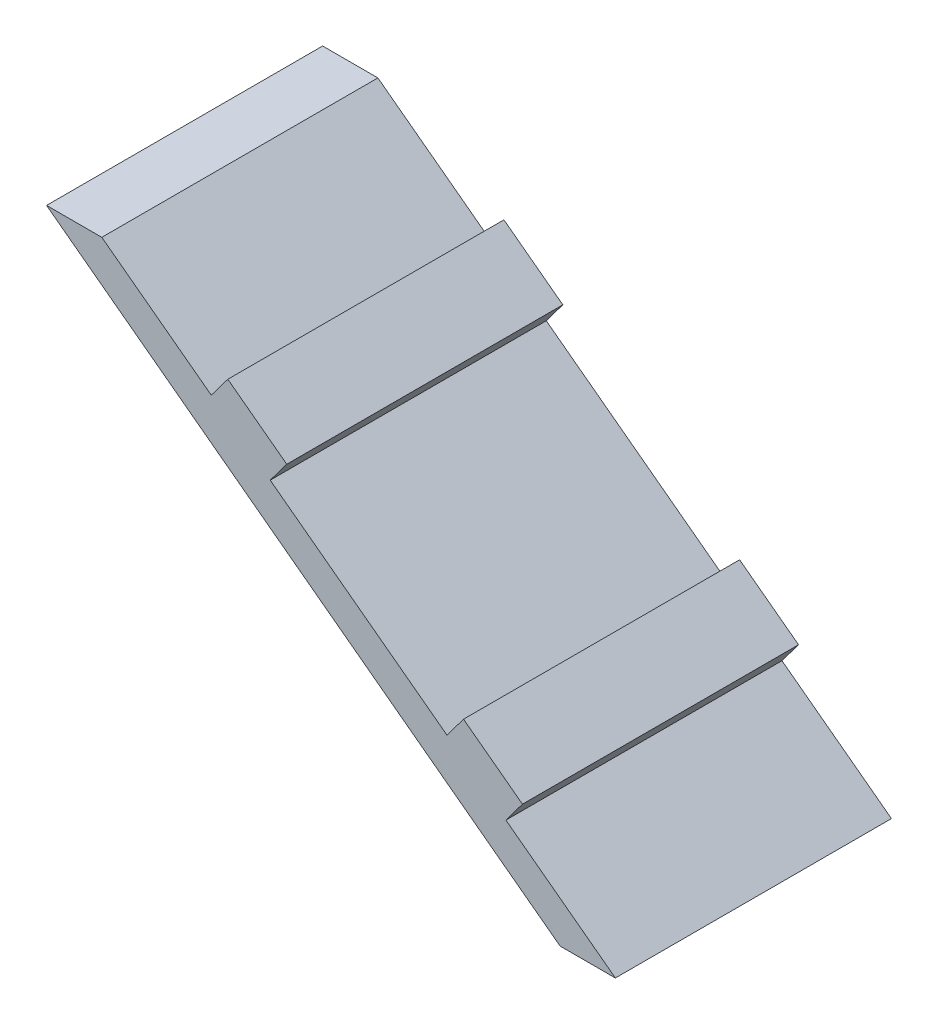
from build123d import *

# Parameters (mm, degrees)
EXTRUDE_1_DEPTH = 150


with BuildPart() as part:
    # 草图1 → 凸台-拉伸1 (new body)
    with BuildSketch(Plane.XY.offset(366)):
        Polygon((-87.024672103, 495), (192, 286), (222.024672103, 286), (-57, 495), align=None)
        Polygon((2.475382036, 450.450696342), (34.490163642, 426.470417805), (43.482768093, 438.475960908), (11.467986487, 462.456239445), align=None)
        Polygon((130.534508461, 354.529582195), (162.549290067, 330.549303658), (171.541894518, 342.55484676), (139.527112912, 366.535125297), align=None)
    extrude(amount=-EXTRUDE_1_DEPTH)


solid = part.part
